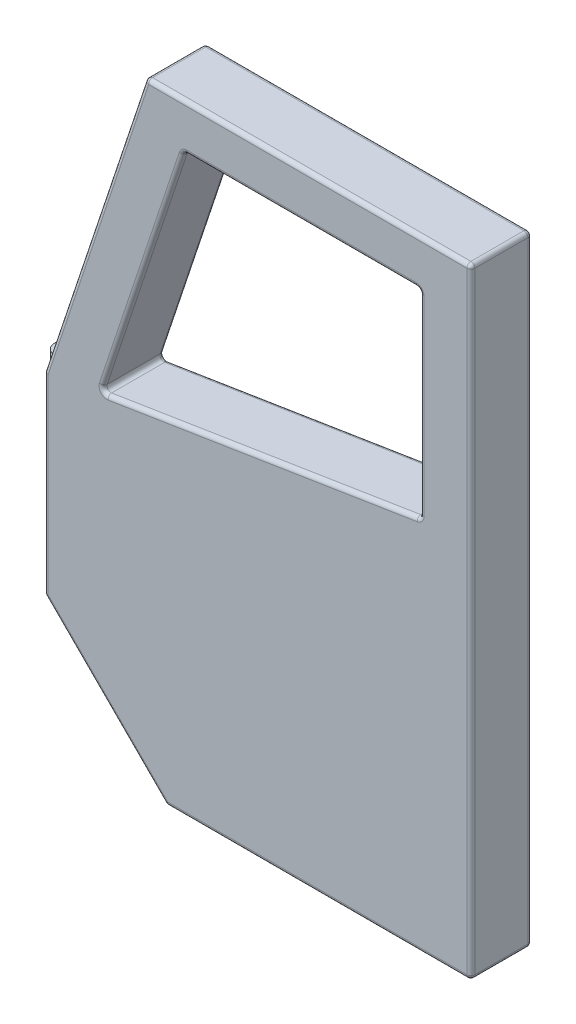
from build123d import *

# Parameters (mm, degrees)
BOSS_EXTRUDE1_DEPTH = 152.4
CUT_EXTRUDE1_DEPTH  = 1888.307171607
FILLET1_R           = 10
BOSS_EXTRUDE2_DEPTH = 476.835088
CUT_EXTRUDE2_REACH  = 1889.307
SKETCH4_W           = 50.8
SKETCH4_H           = 222.835087774
SKETCH6_R           = 15.875
CUT_EXTRUDE3_DEPTH  = 1677.259068793
SKETCH7_W           = 40
SKETCH7_H           = 102.835087774
SKETCH7_R           = 5
BOSS_EXTRUDE3_DEPTH = 25.4


with BuildPart() as part:
    # Sketch1 → Boss-Extrude1 (new body)
    with BuildSketch(Plane.XY):
        Polygon((0, 0), (-762, 0), (-1066.8, 304.8), (-1066.8, 787.4), (-812.8, 1549.4), (0, 1549.4), align=None)
    extrude(amount=BOSS_EXTRUDE1_DEPTH)

    # Sketch2 → Cut-Extrude1 (cut, through all)
    with BuildSketch(Plane.XY.offset(152.4)):
        Polygon((-924.463579053, 812.8), (-127, 939.8), (-127, 1435.1), (-717.03024572, 1435.1), align=None)
    extrude(amount=-CUT_EXTRUDE1_DEPTH, mode=Mode.SUBTRACT)

    # Fillet1
    fillet1_edges = [part.edges().sort_by_distance(p)[0] for p in [
        (0, 0, 76.2),
        (-762, 0, 76.2),
        (-1066.8, 304.8, 76.2),
        (-1066.8, 787.4, 76.2),
        (-812.8, 1549.4, 76.2),
        (0, 1549.4, 76.2),
        (-939.8, 1168.4, 152.4),
        (-1066.8, 546.1, 152.4),
        (-914.4, 152.4, 152.4),
        (-820.746912386, 1123.95, 0),
        (-924.463579053, 812.8, 76.2),
        (-422.01512286, 1435.1, 0),
        (-717.03024572, 1435.1, 76.2),
        (-127, 1187.45, 0),
        (-381, 0, 152.4),
        (-127, 1435.1, 76.2),
        (-525.731789526, 876.3, 0),
        (-127, 939.8, 76.2),
        (-820.746912386, 1123.95, 152.4),
        (-525.731789526, 876.3, 152.4),
        (-127, 1187.45, 152.4),
        (-422.01512286, 1435.1, 152.4),
        (0, 774.7, 152.4),
        (-381, 0, 0),
        (-914.4, 152.4, 0),
        (-1066.8, 546.1, 0),
        (-939.8, 1168.4, 0),
        (-406.4, 1549.4, 0),
        (0, 774.7, 0),
        (-406.4, 1549.4, 152.4),
    ]]
    fillet(fillet1_edges, radius=FILLET1_R)

    # Sketch3 → Boss-Extrude2 (add)
    with BuildSketch(Plane(origin=(0, 308.942135624, 0), x_dir=(-1, 0, 0), z_dir=(0, -1, 0))):
        with BuildLine():
            Line((1066.286832981, -76.2), (1066.286832981, -50.8))
            Line((1066.286832981, -50.8), (1091.686832981, -50.8))
            ThreePointArc((1091.686832981, -50.8), (1117.086832981, -76.2), (1091.686832981, -101.6))
            Line((1091.686832981, -101.6), (1066.286832981, -101.6))
            Line((1066.286832981, -101.6), (1066.286832981, -76.2))
        make_face()
    extrude(amount=-BOSS_EXTRUDE2_DEPTH)

    # Sketch4 → Cut-Extrude2 (cut, up to next)
    with BuildSketch(Plane.ZY.offset(1066.8), mode=Mode.PRIVATE) as cut_extrude2_sk1:
        with Locations((76.2, 547.359679511)):
            Rectangle(SKETCH4_W, SKETCH4_H)
    cut_extrude2_tool1 = extrude(cut_extrude2_sk1.sketch, amount=CUT_EXTRUDE2_REACH, mode=Mode.PRIVATE) & part.part
    add(cut_extrude2_tool1.solids().sort_by_distance((-1066.8, 547.35968, 76.2))[0], mode=Mode.SUBTRACT)

    # Sketch6 → Cut-Extrude3 (cut, through all)
    with BuildSketch(Plane(origin=(0, 308.942135624, 0), x_dir=(-1, 0, 0), z_dir=(0, -1, 0))):
        with Locations(Location((1091.686832981, -76.2, 0), (0, 0, 90))):
            Circle(SKETCH6_R)
    extrude(amount=-CUT_EXTRUDE3_DEPTH, mode=Mode.SUBTRACT)

    # Sketch7 → Boss-Extrude3 (add)
    with BuildSketch(Plane(origin=(0, 0, 0), x_dir=(-1, 0, 0), z_dir=(0, 0, -1))):
        with Locations((1036.8, 547.359679511)):
            Rectangle(SKETCH7_W, SKETCH7_H)
        with Locations((1036.8, 573.359679511)):
            Circle(SKETCH7_R, mode=Mode.SUBTRACT)
        with Locations((1036.8, 521.359679511)):
            Circle(SKETCH7_R, mode=Mode.SUBTRACT)
    extrude(amount=BOSS_EXTRUDE3_DEPTH)


solid = part.part
